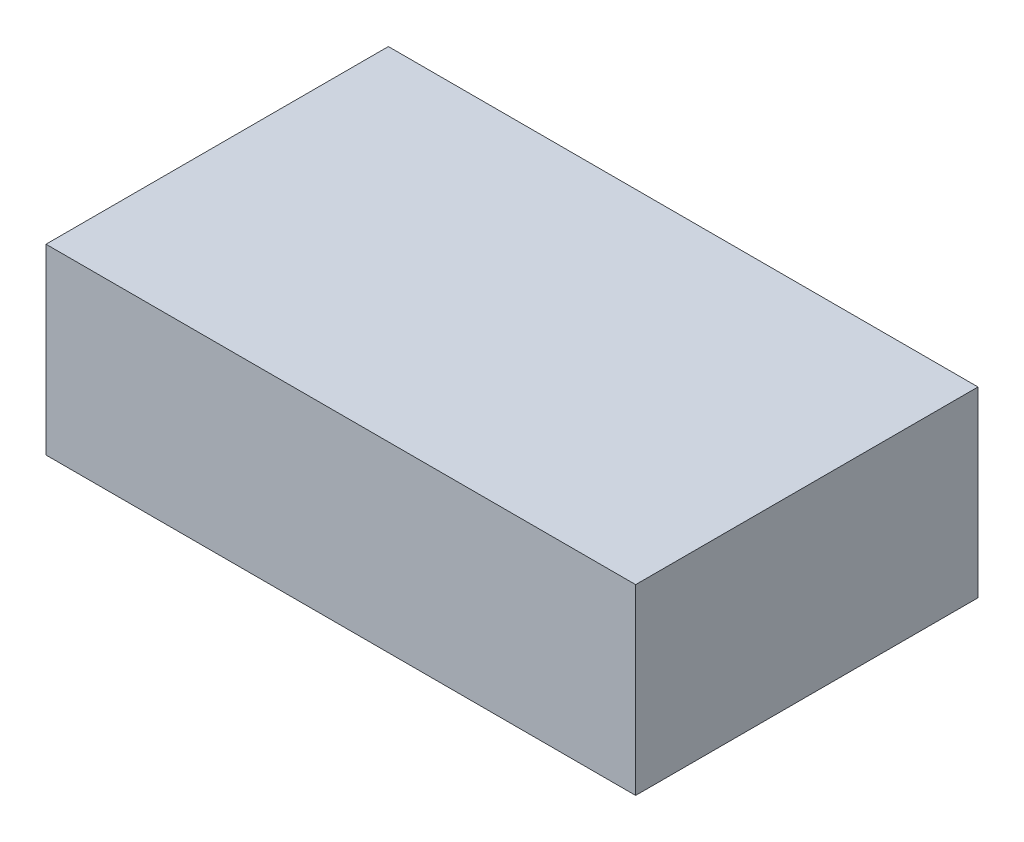
from build123d import *

# Parameters (mm, degrees)
SKETCH_1_W      = 46.5
SKETCH_1_H      = 27
EXTRUDE_1_DEPTH = 14.4


with BuildPart() as part:
    # 스케치1 → 보스-돌출1 (new body)
    with BuildSketch(Plane(origin=(0, 0, 0), x_dir=(1, 0, 0), z_dir=(0, 1, 0))):
        with Locations((23.25, 13.5)):
            Rectangle(SKETCH_1_W, SKETCH_1_H)
    extrude(amount=EXTRUDE_1_DEPTH)


solid = part.part
